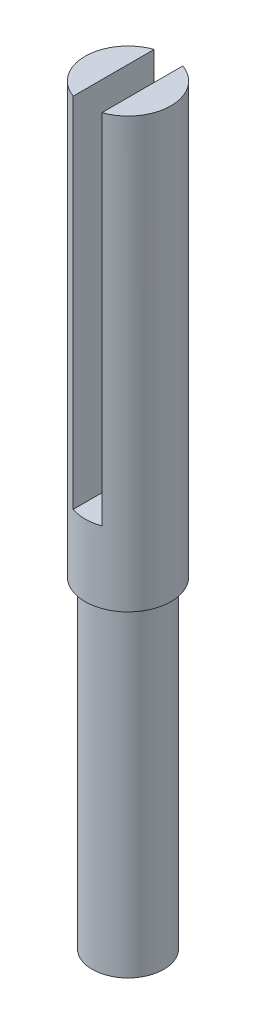
from build123d import *

# Parameters (mm, degrees)
SKETCH1_R               = 6
BOSS_EXTRUDE1_DEPTH     = 5
BOSS_EXTRUDE2_START     = 100
SKETCH2_R               = 6
BOSS_EXTRUDE2_DEPTH     = 100
CUT_EXTRUDE1_DEPTH      = 101.359354322
CUT_EXTRUDE1_DEPTH_BACK = 101.359354322
SKETCH3_W               = 4
SKETCH3_H               = 50
SKETCH4_R               = 6
SKETCH4_R_2             = 5
CUT_EXTRUDE2_DEPTH      = 45


with BuildPart() as part:
    # Sketch1 → Boss-Extrude1 (new body)
    with BuildSketch(Plane(origin=(0, 0, 0), x_dir=(1, 0, 0), z_dir=(0, 1, 0))):
        with Locations(Location((0, 0, 0), (0, 0, 270))):
            Circle(SKETCH1_R)
    extrude(amount=BOSS_EXTRUDE1_DEPTH)

    # Sketch2 → Boss-Extrude2 (add)
    with BuildSketch(Plane.XZ.offset(BOSS_EXTRUDE2_START)):
        with Locations(Location((0, 0, 0), (0, 0, 270))):
            Circle(SKETCH2_R)
    extrude(amount=-BOSS_EXTRUDE2_DEPTH)

    # Sketch3 → Cut-Extrude1 (cut, two sides: drawn at the far end of the back side and taken through both)
    with BuildSketch(Plane.XY.offset(-CUT_EXTRUDE1_DEPTH_BACK)):
        with Locations((0, -20)):
            Rectangle(SKETCH3_W, SKETCH3_H)
    extrude(amount=CUT_EXTRUDE1_DEPTH + CUT_EXTRUDE1_DEPTH_BACK, mode=Mode.SUBTRACT)

    # Sketch4 → Cut-Extrude2 (cut)
    with BuildSketch(Plane.XZ.offset(100)):
        with Locations(Location((0, 0, 0), (0, 0, 270))):
            Circle(SKETCH4_R)
        with Locations(Location((0, 0, 0), (0, 0, 270))):
            Circle(SKETCH4_R_2, mode=Mode.SUBTRACT)
    extrude(amount=-CUT_EXTRUDE2_DEPTH, mode=Mode.SUBTRACT)


solid = part.part
